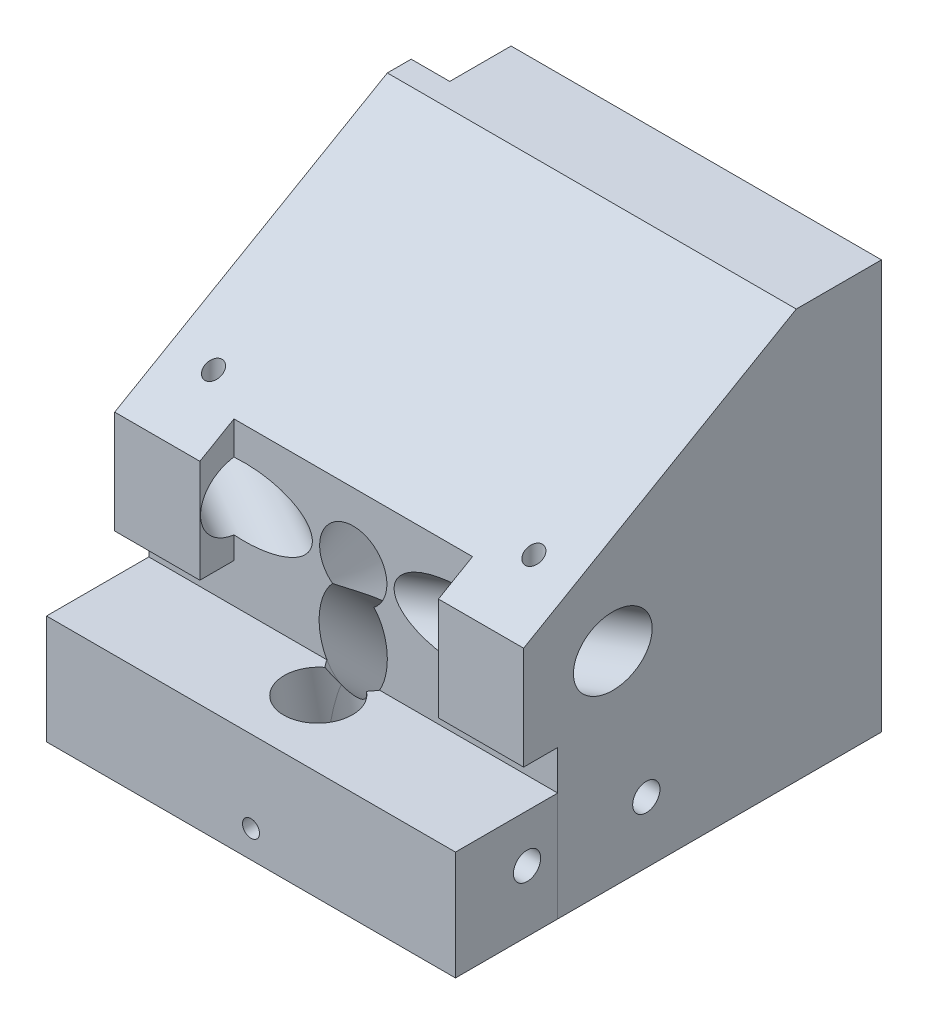
from build123d import *

# Parameters (mm, degrees)
SKETCH_1_W                  = 120.00000000000001
SKETCH_1_H                  = 120.00000000000001
EXTRUDE_1_DEPTH             = 95
SKETCH_2_R                  = 47.15
CUT_EXTRUDE_2_DEPTH         = 18
CHAMFER_1_SIZE              = 70
CHAMFER_1_SIZE2             = 40.41451884327391
CUT_EXTRUDE_4_DEPTH         = 18
CUT_EXTRUDE_5_DEPTH         = 187.12210938827934
CUT_EXTRUDE_5_DEPTH_BACK    = 187.12210938827934
SKETCH_6_R                  = 9.999999999999995
CUT_EXTRUDE_6_DEPTH         = 161.29990766328402
CUT_EXTRUDE_6_DEPTH_BACK    = 161.29990766328402
SKETCH_7_R                  = 10.000000000000007
SKETCH_9_W                  = 120.00000000000001
SKETCH_9_H                  = 32
EXTRUDE_2_DEPTH             = 30
CUT_EXTRUDE_7_DEPTH         = 161.19519343600803
CUT_EXTRUDE_7_DEPTH_BACK    = 161.19519343600803
SKETCH_8_R                  = 10.000000000000002
CUT_EXTRUDE_8_DEPTH         = 161.19519343600803
EXTRUDE_3_DEPTH             = 10
CUT_EXTRUDE_11_DEPTH        = 208.20552853813194
CUT_EXTRUDE_12_DEPTH        = 176.70162320495896
CUT_EXTRUDE_13_DEPTH        = 211.77238908357995
CUT_EXTRUDE_9_DEPTH         = 198.03691646492257
CUT_EXTRUDE_9_DEPTH_BACK    = 198.03691646492257
SKETCH_12_R                 = 9.999999999999993
CUT_EXTRUDE_10_DEPTH        = 198.03691646492257
CUT_EXTRUDE_10_DEPTH_BACK   = 198.03691646492257
SKETCH_13_R                 = 9.999999999999993
HOLE_WIZARD_M6_1_AT_2_COUNT = 2
HOLE_WIZARD_M6_1_AT_2_PITCH = 70.00000000000001
HOLE_WIZARD_M6_1_AT_3_COUNT = 2
HOLE_WIZARD_M6_1_AT_3_PITCH = 122.06555615733703
HOLE_WIZARD_M6_1_AT_4_COUNT = 2
HOLE_WIZARD_M6_1_AT_4_PITCH = 99.99999999999999
HOLE_WIZARD_M6_2_AT_2_COUNT = 2
HOLE_WIZARD_M6_2_AT_2_PITCH = 94.00000000000001
SKETCH_24_R                 = 4.000000000000005
CUT_EXTRUDE_14_DEPTH        = 30
HOLE_WIZARD_M6_4_AT_2_COUNT = 2
HOLE_WIZARD_M6_4_AT_2_PITCH = 35.000000000000014
HOLE_WIZARD_M5_1_AT_2_COUNT = 2
HOLE_WIZARD_M5_1_AT_2_PITCH = 63.91995004591518
HOLE_WIZARD_M5_1_AT_3_COUNT = 2
HOLE_WIZARD_M5_1_AT_3_PITCH = 104.10171044425002
HOLE_WIZARD_M5_1_AT_4_COUNT = 2
HOLE_WIZARD_M5_1_AT_4_PITCH = 83.30210073057981


with BuildPart() as part:
    # 草图1 → 凸台-拉伸1 (new body)
    with BuildSketch(Plane.XY):
        with Locations((60.00000000000001, 60.00000000000001)):
            Rectangle(SKETCH_1_W, SKETCH_1_H)
    extrude(amount=EXTRUDE_1_DEPTH)

    # 草图2 → 切除-拉伸2 (cut)
    with BuildSketch(Plane(origin=(0, 0, 0), x_dir=(-1, 0, 0), z_dir=(0, 0, -1))):
        with Locations((-60, 59.99999999999999)):
            Circle(SKETCH_2_R)
    extrude(amount=-CUT_EXTRUDE_2_DEPTH, mode=Mode.SUBTRACT)

    # 切除-拉伸3 cone 1 section (through the dimple's axis) → 切除-拉伸3 (revolve, cut)
    with BuildSketch(Plane(origin=(60, 60, 18), x_dir=(0, 1, 0), z_dir=(1, 0, 0))):
        Polygon((0, 0), (44.15, 0), (0, 99.162523568), align=None)
    revolve(axis=Axis((60, 60, 18), (0, 0, 1)), mode=Mode.SUBTRACT)

    # 倒角1
    chamfer_1_edges = [part.edges().sort_by_distance(p)[0] for p in [
        (60, 120, 95),
    ]]
    chamfer_1_side = [part.faces().sort_by_distance(p)[0] for p in [
        (60, 120, 47.5),
    ]]
    chamfer(chamfer_1_edges, length=CHAMFER_1_SIZE, length2=CHAMFER_1_SIZE2, reference=chamfer_1_side[0])

    # 草图5 → 切除-拉伸4 (cut)
    with BuildSketch(Plane(origin=(0, 0, 0), x_dir=(-1, 0, 0), z_dir=(0, 0, -1))):
        Polygon((-40.90811690796328, 90.40559159102156), (3.8231419763606613, 135.13685047534565), (15.136850475345431, 123.82314197636093), (-29.594408408978502, 79.09188309203682), align=None)
    extrude(amount=-CUT_EXTRUDE_4_DEPTH, mode=Mode.SUBTRACT)

    # 草图6 → 切除-拉伸5 (cut, two sides: drawn at the far end of the back side and taken through both)
    with BuildSketch(Plane(origin=(48.863793320238976, 0, -28.21152422706628), x_dir=(-0.500000000000001, 0, -0.866025403784438), z_dir=(0.866025403784438, 0, -0.500000000000001)).offset(-CUT_EXTRUDE_5_DEPTH_BACK)):
        with Locations((-128.27241335952172, 59.99999999999999)):
            Circle(SKETCH_6_R)
    extrude(amount=CUT_EXTRUDE_5_DEPTH + CUT_EXTRUDE_5_DEPTH_BACK, mode=Mode.SUBTRACT)

    # 草图7 → 切除-拉伸6 (cut, two sides: drawn at the far end of the back side and taken through both)
    with BuildSketch(Plane(origin=(41.136206679760896, 0, 23.750000000000096), x_dir=(-0.500000000000001, 0, 0.866025403784438), z_dir=(-0.866025403784438, 0, -0.500000000000001)).offset(-CUT_EXTRUDE_6_DEPTH_BACK)):
        with Locations((68.27241335952161, 59.99999999999999)):
            Circle(SKETCH_7_R)
    extrude(amount=CUT_EXTRUDE_6_DEPTH + CUT_EXTRUDE_6_DEPTH_BACK, mode=Mode.SUBTRACT)

    # 草图8 → 切除-拉伸7 (cut, two sides: drawn at the far end of the back side and taken through both)
    with BuildSketch(Plane(origin=(0, 47.49999999999999, 47.49999999999983), x_dir=(1, 0, 0), z_dir=(0, 0.7071067811865488, 0.7071067811865462)).offset(-CUT_EXTRUDE_7_DEPTH_BACK)):
        with Locations(Location((60.00000000000001, -38.17514421272213, 0), (0, 0, 90))):
            Circle(SKETCH_8_R)
    extrude(amount=CUT_EXTRUDE_7_DEPTH + CUT_EXTRUDE_7_DEPTH_BACK, mode=Mode.SUBTRACT)

    # 草图14 → 凸台-拉伸3 (add)
    with BuildSketch(Plane.XY.offset(95)):
        Polygon((120, 79.58548115672617), (94.99999999999999, 79.58548115672617), (95, 43.58548115672617), (120, 43.585481156726175), align=None)
        Polygon((25.000000000000007, 79.58548115672616), (25.000000000000007, 43.58548115672616), (0, 43.585481156726175), (0, 79.58548115672617), align=None)
    extrude(amount=EXTRUDE_3_DEPTH)

    # 草图15 → 切除-拉伸11 (cut, through all)
    with BuildSketch(Plane(origin=(48.863793320238976, 0, -28.21152422706628), x_dir=(-0.500000000000001, 0, -0.866025403784438), z_dir=(0.866025403784438, 0, -0.500000000000001))):
        with BuildLine():
            Line((-129.77241335952172, 50.1131400333574), (-129.7724133595217, 69.88685996664258))
            ThreePointArc((-129.7724133595217, 69.88685996664258), (-138.2724133595217, 60.00000000000001), (-129.77241335952172, 50.1131400333574))
        make_face()
    extrude(amount=-CUT_EXTRUDE_11_DEPTH, mode=Mode.SUBTRACT)

    # 草图16 → 切除-拉伸12 (cut, through all)
    with BuildSketch(Plane(origin=(41.136206679760896, 0, 23.750000000000096), x_dir=(-0.500000000000001, 0, 0.866025403784438), z_dir=(-0.866025403784438, 0, -0.500000000000001))):
        with BuildLine():
            Line((69.77241335952158, 69.8868599666426), (69.77241335952156, 50.113140033357375))
            ThreePointArc((69.77241335952156, 50.113140033357375), (78.27241335952161, 59.999999999999986), (69.77241335952158, 69.8868599666426))
        make_face()
    extrude(amount=-CUT_EXTRUDE_12_DEPTH, mode=Mode.SUBTRACT)

    # 草图17 → 切除-拉伸13 (cut, through all)
    with BuildSketch(Plane(origin=(120, 0, 0), x_dir=(0, 0, -1), z_dir=(1, 0, 0))):
        Polygon((-95, 79.58548115672617), (-114.0318759578301, 68.59742244928917), (-114.03187595783007, 79.58548115672617), align=None)
    extrude(amount=-CUT_EXTRUDE_13_DEPTH, mode=Mode.SUBTRACT)

    # 草图13 → 切除-拉伸10 (cut, two sides: drawn at the far end of the back side and taken through both)
    with BuildSketch(Plane(origin=(0, 21.37625895785434, 3.7692112008807417), x_dir=(1, 0, 0), z_dir=(0, -0.984807753012208, -0.17364817766693072)).offset(-CUT_EXTRUDE_10_DEPTH_BACK)):
        with Locations((60, 98.10096912652598)):
            Circle(SKETCH_13_R)
    extrude(amount=CUT_EXTRUDE_10_DEPTH + CUT_EXTRUDE_10_DEPTH_BACK, mode=Mode.SUBTRACT)

    # 草图18 → M6 螺纹孔1 (revolve, cut)
    with BuildSketch(Plane(origin=(109.99999999999997, 0, 12.50000000000004), x_dir=(0, 0, -1), z_dir=(1, 0, 0))):
        Polygon((0, 0), (-4.04e-15, 16.5021515475689), (2.4999999999999885, 15), (2.4999999999999902, -1.25e-15), align=None)
    hole_wizard_m6_1 = revolve(axis=Axis((109.99999999999997, -6.349999999999991, 12.50000000000004), (0, 1, 0)), mode=Mode.SUBTRACT)

    # M6 螺纹孔1 at 2: M6 螺纹孔1 ×2
    with Locations(*[(0, 0, i * HOLE_WIZARD_M6_1_AT_2_PITCH) for i in range(1, HOLE_WIZARD_M6_1_AT_2_COUNT)]):
        add(hole_wizard_m6_1, mode=Mode.SUBTRACT)

    # M6 螺纹孔1 at 3: M6 螺纹孔1 ×2
    with Locations(*[Vector(-0.8192319205190404, 0, 0.5734623443633284) * (i * HOLE_WIZARD_M6_1_AT_3_PITCH) for i in range(1, HOLE_WIZARD_M6_1_AT_3_COUNT)]):
        add(hole_wizard_m6_1, mode=Mode.SUBTRACT)

    # M6 螺纹孔1 at 4: M6 螺纹孔1 ×2
    with Locations(*[(-i * HOLE_WIZARD_M6_1_AT_4_PITCH, 0, 0) for i in range(1, HOLE_WIZARD_M6_1_AT_4_COUNT)]):
        add(hole_wizard_m6_1, mode=Mode.SUBTRACT)

    # 草图20 → M6 螺纹孔2 (revolve, cut)
    with BuildSketch(Plane(origin=(107.00000000000001, 120, 89), x_dir=(0, 0, 1), z_dir=(1, 0, 0))):
        Polygon((0, 0), (-1.629e-14, 66.5021515475689), (2.499999999999985, 65), (2.4999999999999902, -1.25e-15), align=None)
    hole_wizard_m6_2 = revolve(axis=Axis((107.00000000000001, 126.35, 89), (0, -1, 0)), mode=Mode.SUBTRACT)

    # M6 螺纹孔2 at 2: M6 螺纹孔2 ×2
    with Locations(*[(-i * HOLE_WIZARD_M6_2_AT_2_PITCH, 0, 0) for i in range(1, HOLE_WIZARD_M6_2_AT_2_COUNT)]):
        add(hole_wizard_m6_2, mode=Mode.SUBTRACT)


with BuildPart() as body_2:
    # 草图9 → 凸台-拉伸2 (new body)
    with BuildSketch(Plane.XY.offset(95)):
        with Locations((60.00000000000001, 16)):
            Rectangle(SKETCH_9_W, SKETCH_9_H)
    extrude(amount=EXTRUDE_2_DEPTH)

    # 草图11 → 切除-拉伸8 (cut, through all)
    with BuildSketch(Plane(origin=(0, 47.49999999999999, 47.49999999999983), x_dir=(1, 0, 0), z_dir=(0, 0.7071067811865488, 0.7071067811865462))):
        with BuildLine():
            Line((66.08634122035335, -30.240634111308978), (53.913658779646646, -30.24063411130897))
            ThreePointArc((53.913658779646646, -30.24063411130897), (60.000000000000014, -48.17514421272215), (66.08634122035335, -30.240634111308978))
        make_face()
    extrude(amount=CUT_EXTRUDE_8_DEPTH, mode=Mode.SUBTRACT)

    # 草图12 → 切除-拉伸9 (cut, two sides: drawn at the far end of the back side and taken through both)
    with BuildSketch(Plane(origin=(0, 21.37625895785434, 3.7692112008807417), x_dir=(1, 0, 0), z_dir=(0, -0.984807753012208, -0.17364817766693072)).offset(-CUT_EXTRUDE_9_DEPTH_BACK)):
        with Locations((60, 98.100969126526)):
            Circle(SKETCH_12_R)
    extrude(amount=CUT_EXTRUDE_9_DEPTH + CUT_EXTRUDE_9_DEPTH_BACK, mode=Mode.SUBTRACT)

    # 草图22 → M6 螺纹孔3 (revolve, cut)
    with BuildSketch(Plane(origin=(60, 8.000000000000004, 125), x_dir=(0, -1, 0), z_dir=(1, 0, 0))):
        Polygon((0, 0), (-4.78e-15, 19.502151547568907), (2.499999999999996, 18.000000000000004), (2.4999999999999902, -1.25e-15), align=None)
    revolve(axis=Axis((60, 8.000000000000004, 131.35), (0, 0, -1)), mode=Mode.SUBTRACT)


with BuildPart() as cut_extrude_14_tool:
    # 草图24 → 切除-拉伸14 (new body)
    with BuildSketch(Plane(origin=(120, 0, 0), x_dir=(0, 0, -1), z_dir=(1, 0, 0))):
        with Locations((-104, 18)):
            Circle(SKETCH_24_R)
        with Locations((-68.99999999999999, 18.000000000000004)):
            Circle(SKETCH_24_R)
    extrude(amount=-CUT_EXTRUDE_14_DEPTH)


with BuildPart() as part_1:
    add(part.part)

    # 切除-拉伸14: cut by cut_extrude_14_tool
    add(cut_extrude_14_tool.part, mode=Mode.SUBTRACT)

    # 草图25 → M6 螺纹孔4 (revolve, cut)
    with BuildSketch(Plane(origin=(90, 18.000000000000004, 68.99999999999999), x_dir=(0, 0, -1), z_dir=(0, 1, 0))):
        Polygon((0, 0), (-8.94e-15, 36.50215154756891), (2.499999999999992, 35), (2.4999999999999902, -1.25e-15), align=None)
    hole_wizard_m6_4 = revolve(axis=Axis((96.35, 18.000000000000004, 68.99999999999999), (-1, 0, 0)), mode=Mode.SUBTRACT)

    # 草图27 → M5 螺纹孔1 (revolve, cut)
    with BuildSketch(Plane(origin=(33.750000000000284, 105.46633369868316, 0), x_dir=(0, 1, 0), z_dir=(1, 0, 0))):
        Polygon((0, 0), (-3.35e-15, 13.661807299957877), (2.0999999999999948, 12.400000000000002), (2.099999999999996, -5e-17), align=None)
    hole_wizard_m5_1 = revolve(axis=Axis((33.750000000000284, 105.46633369868316, -6.349999999999991), (0, 0, 1)), mode=Mode.SUBTRACT)

    # M5 螺纹孔1 at 2: M5 螺纹孔1 ×2
    with Locations(*[Vector(0.9914448613738105, -0.1305261922200519, 0) * (i * HOLE_WIZARD_M5_1_AT_2_PITCH) for i in range(1, HOLE_WIZARD_M5_1_AT_2_COUNT)]):
        add(hole_wizard_m5_1, mode=Mode.SUBTRACT)

    # M5 螺纹孔1 at 3: M5 螺纹孔1 ×2
    with Locations(*[Vector(0.6087614290087188, -0.7933533402912366, 0) * (i * HOLE_WIZARD_M5_1_AT_3_PITCH) for i in range(1, HOLE_WIZARD_M5_1_AT_3_COUNT)]):
        add(hole_wizard_m5_1, mode=Mode.SUBTRACT)

    # M5 螺纹孔1 at 4: M5 螺纹孔1 ×2
    with Locations(*[Vector(-0.13052619222005576, -0.9914448613738099, 0) * (i * HOLE_WIZARD_M5_1_AT_4_PITCH) for i in range(1, HOLE_WIZARD_M5_1_AT_4_COUNT)]):
        add(hole_wizard_m5_1, mode=Mode.SUBTRACT)


with BuildPart() as body_2_1:
    add(body_2.part)

    # 切除-拉伸14: cut by cut_extrude_14_tool
    add(cut_extrude_14_tool.part, mode=Mode.SUBTRACT)

    # M6 螺纹孔4 at 2: M6 螺纹孔4 ×2
    with Locations(*[(0, 0, i * HOLE_WIZARD_M6_4_AT_2_PITCH) for i in range(1, HOLE_WIZARD_M6_4_AT_2_COUNT)]):
        add(hole_wizard_m6_4, mode=Mode.SUBTRACT)


solid = Compound([part_1.part, body_2_1.part])
